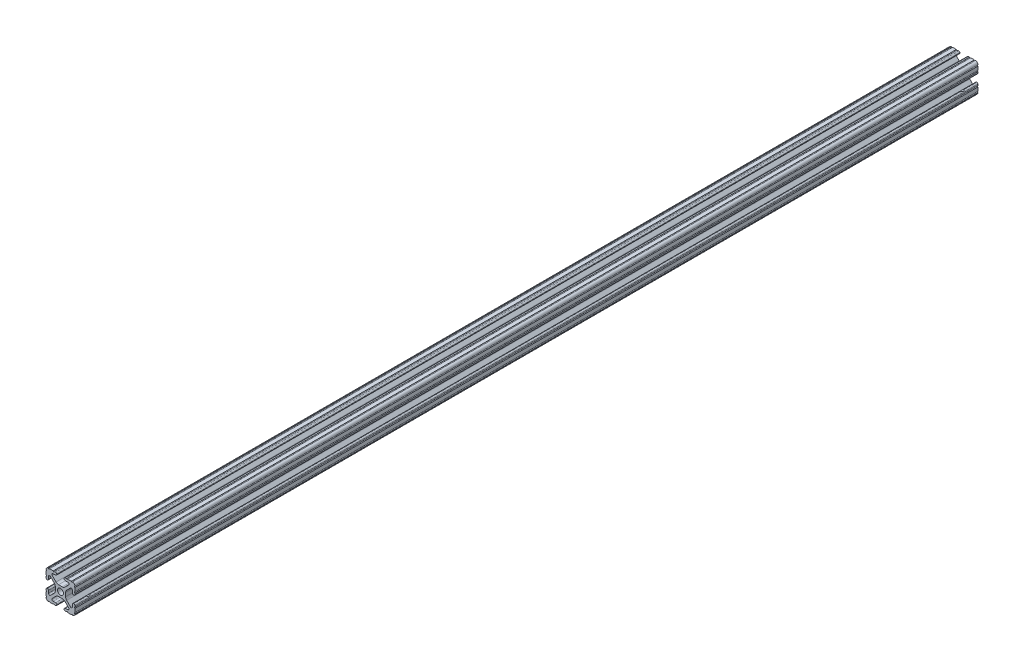
from build123d import *

# Parameters (mm, degrees)
SKETCH1_R               = 2.6035
BOSS_EXTRUDE1_DEPTH     = 396.735
CUT_EXTRUDE1_DEPTH      = 398.31106541
CUT_EXTRUDE1_DEPTH_BACK = 398.31106541
SKETCH2_R               = 3.5


with BuildPart() as part:
    # Sketch1 → Boss-Extrude1 (new, symmetric)
    with BuildSketch(Plane.XY):
        with BuildLine():
            Line((-7.179650497, -8.645192506), (-3.952270251, -5.423690499))
            ThreePointArc((-3.952270251, -5.423690499), (-2.922936451, -4.736929036), (-1.709253557, -4.4958))
            Line((-1.709253557, -4.4958), (1.709253557, -4.4958))
            ThreePointArc((1.709253557, -4.4958), (2.922936451, -4.736929036), (3.952270251, -5.423690499))
            Line((3.952270251, -5.423690499), (7.179650497, -8.645192506))
            ThreePointArc((7.179650497, -8.645192506), (7.41473083, -9.822813117), (6.416408329, -10.4902))
            Line((6.416408329, -10.4902), (4.287512407, -10.4902))
            ThreePointArc((4.287512407, -10.4902), (3.54574862, -10.79744862), (3.2385, -11.539212407))
            Line((3.2385, -11.539212407), (3.2385, -11.650987593))
            ThreePointArc((3.2385, -11.650987593), (3.54574862, -12.39275138), (4.287512407, -12.7))
            Line((4.287512407, -12.7), (5.317126718, -12.7))
            ThreePointArc((5.317126718, -12.7), (5.825126718, -12.192), (6.333126718, -12.7))
            Line((6.333126718, -12.7), (9.550443118, -12.7))
            ThreePointArc((9.550443118, -12.7), (10.058366869, -12.192000006), (10.566443095, -12.699847501))
            ThreePointArc((10.566443095, -12.699847501), (12.082537762, -12.08250727), (12.699846982, -10.566399977))
            ThreePointArc((12.699846982, -10.566399977), (12.192000006, -10.058323491), (12.7, -9.5504))
            Line((12.7, -9.5504), (12.7, -6.3330836))
            ThreePointArc((12.7, -6.3330836), (12.192, -5.8250836), (12.7, -5.3170836))
            Line((12.7, -5.3170836), (12.7, -4.287469289))
            ThreePointArc((12.7, -4.287469289), (12.39275138, -3.545705502), (11.650987593, -3.238456882))
            Line((11.650987593, -3.238456882), (11.539212407, -3.238456882))
            ThreePointArc((11.539212407, -3.238456882), (10.79744862, -3.545705502), (10.4902, -4.287469289))
            Line((10.4902, -4.287469289), (10.4902, -6.402089023))
            ThreePointArc((10.4902, -6.402089023), (9.856505071, -7.351067942), (8.737131347, -7.129408934))
            Line((8.737131347, -7.129408934), (5.441005833, -3.840816462))
            ThreePointArc((5.441005833, -3.840816462), (4.750877967, -2.809883091), (4.5085, -1.593185507))
            Line((4.5085, -1.593185507), (4.5085, 1.593185507))
            ThreePointArc((4.5085, 1.593185507), (4.750877967, 2.809883091), (5.441005833, 3.840816462))
            Line((5.441005833, 3.840816462), (8.737131347, 7.129408934))
            ThreePointArc((8.737131347, 7.129408934), (9.856505071, 7.351067942), (10.4902, 6.402089023))
            Line((10.4902, 6.402089023), (10.4902, 4.287469289))
            ThreePointArc((10.4902, 4.287469289), (10.79744862, 3.545705502), (11.539212407, 3.238456882))
            Line((11.539212407, 3.238456882), (11.650987593, 3.238456882))
            ThreePointArc((11.650987593, 3.238456882), (12.39275138, 3.545705502), (12.7, 4.287469289))
            Line((12.7, 4.287469289), (12.7, 5.3170836))
            ThreePointArc((12.7, 5.3170836), (12.192, 5.8250836), (12.7, 6.3330836))
            Line((12.7, 6.3330836), (12.7, 9.5504))
            ThreePointArc((12.7, 9.5504), (12.192000006, 10.058323491), (12.699846982, 10.566399977))
            ThreePointArc((12.699846982, 10.566399977), (12.082537762, 12.08250727), (10.566443095, 12.699847501))
            ThreePointArc((10.566443095, 12.699847501), (10.058366869, 12.192000006), (9.550443118, 12.7))
            Line((9.550443118, 12.7), (6.333126718, 12.7))
            ThreePointArc((6.333126718, 12.7), (5.825126718, 12.192), (5.317126718, 12.7))
            Line((5.317126718, 12.7), (4.287512407, 12.7))
            ThreePointArc((4.287512407, 12.7), (3.54574862, 12.39275138), (3.2385, 11.650987593))
            Line((3.2385, 11.650987593), (3.2385, 11.539212407))
            ThreePointArc((3.2385, 11.539212407), (3.54574862, 10.79744862), (4.287512407, 10.4902))
            Line((4.287512407, 10.4902), (6.476788598, 10.4902))
            ThreePointArc((6.476788598, 10.4902), (7.432222385, 9.85140422), (7.207036008, 8.724370562))
            Line((7.207036008, 8.724370562), (3.898272566, 5.423169045))
            ThreePointArc((3.898272566, 5.423169045), (2.869120213, 4.736787962), (1.655778399, 4.4958))
            Line((1.655778399, 4.4958), (-1.655778399, 4.4958))
            ThreePointArc((-1.655778399, 4.4958), (-2.869120213, 4.736787962), (-3.898272566, 5.423169045))
            Line((-3.898272566, 5.423169045), (-7.207036008, 8.724370562))
            ThreePointArc((-7.207036008, 8.724370562), (-7.432222385, 9.85140422), (-6.476788598, 10.4902))
            Line((-6.476788598, 10.4902), (-4.287512407, 10.4902))
            ThreePointArc((-4.287512407, 10.4902), (-3.54574862, 10.79744862), (-3.2385, 11.539212407))
            Line((-3.2385, 11.539212407), (-3.2385, 11.650987593))
            ThreePointArc((-3.2385, 11.650987593), (-3.54574862, 12.39275138), (-4.287512407, 12.7))
            Line((-4.287512407, 12.7), (-5.317126718, 12.7))
            ThreePointArc((-5.317126718, 12.7), (-5.825126718, 12.192), (-6.333126718, 12.7))
            Line((-6.333126718, 12.7), (-9.550443118, 12.7))
            ThreePointArc((-9.550443118, 12.7), (-10.058366869, 12.192000006), (-10.566443095, 12.699847501))
            ThreePointArc((-10.566443095, 12.699847501), (-12.082537762, 12.08250727), (-12.699846982, 10.566399977))
            ThreePointArc((-12.699846982, 10.566399977), (-12.192000006, 10.058323491), (-12.7, 9.5504))
            Line((-12.7, 9.5504), (-12.7, 6.3330836))
            ThreePointArc((-12.7, 6.3330836), (-12.192, 5.8250836), (-12.7, 5.3170836))
            Line((-12.7, 5.3170836), (-12.7, 4.287469289))
            ThreePointArc((-12.7, 4.287469289), (-12.39275138, 3.545705502), (-11.650987593, 3.238456882))
            Line((-11.650987593, 3.238456882), (-11.539212407, 3.238456882))
            ThreePointArc((-11.539212407, 3.238456882), (-10.79744862, 3.545705502), (-10.4902, 4.287469289))
            Line((-10.4902, 4.287469289), (-10.4902, 6.402089023))
            ThreePointArc((-10.4902, 6.402089023), (-9.856505071, 7.351067942), (-8.737131347, 7.129408934))
            Line((-8.737131347, 7.129408934), (-5.441005833, 3.840816462))
            ThreePointArc((-5.441005833, 3.840816462), (-4.750877967, 2.809883091), (-4.5085, 1.593185507))
            Line((-4.5085, 1.593185507), (-4.5085, -1.593185507))
            ThreePointArc((-4.5085, -1.593185507), (-4.750877967, -2.809883091), (-5.441005833, -3.840816462))
            Line((-5.441005833, -3.840816462), (-8.737131347, -7.129408934))
            ThreePointArc((-8.737131347, -7.129408934), (-9.856505071, -7.351067942), (-10.4902, -6.402089023))
            Line((-10.4902, -6.402089023), (-10.4902, -4.287469289))
            ThreePointArc((-10.4902, -4.287469289), (-10.79744862, -3.545705502), (-11.539212407, -3.238456882))
            Line((-11.539212407, -3.238456882), (-11.650987593, -3.238456882))
            ThreePointArc((-11.650987593, -3.238456882), (-12.39275138, -3.545705502), (-12.7, -4.287469289))
            Line((-12.7, -4.287469289), (-12.7, -5.3170836))
            ThreePointArc((-12.7, -5.3170836), (-12.192, -5.8250836), (-12.7, -6.3330836))
            Line((-12.7, -6.3330836), (-12.7, -9.5504))
            ThreePointArc((-12.7, -9.5504), (-12.192000006, -10.058323491), (-12.699846982, -10.566399977))
            ThreePointArc((-12.699846982, -10.566399977), (-12.082537762, -12.08250727), (-10.566443095, -12.699847501))
            ThreePointArc((-10.566443095, -12.699847501), (-10.058366869, -12.192000006), (-9.550443118, -12.7))
            Line((-9.550443118, -12.7), (-6.333126718, -12.7))
            ThreePointArc((-6.333126718, -12.7), (-5.825126718, -12.192), (-5.317126718, -12.7))
            Line((-5.317126718, -12.7), (-4.287512407, -12.7))
            ThreePointArc((-4.287512407, -12.7), (-3.54574862, -12.39275138), (-3.2385, -11.650987593))
            Line((-3.2385, -11.650987593), (-3.2385, -11.539212407))
            ThreePointArc((-3.2385, -11.539212407), (-3.54574862, -10.79744862), (-4.287512407, -10.4902))
            Line((-4.287512407, -10.4902), (-6.416408329, -10.4902))
            ThreePointArc((-6.416408329, -10.4902), (-7.41473083, -9.822813117), (-7.179650497, -8.645192506))
        make_face()
        Circle(SKETCH1_R, mode=Mode.SUBTRACT)
    extrude(amount=BOSS_EXTRUDE1_DEPTH, both=True)

    # Sketch2 → Cut-Extrude1 (cut, two sides: drawn at the far end of the back side and taken through both)
    with BuildSketch(Plane(origin=(4.5085, 0, 0), x_dir=(0, 0, -1), z_dir=(1, 0, 0)).offset(-CUT_EXTRUDE1_DEPTH_BACK)):
        with Locations(Location((-384.035, 0, 0), (0, 0, 152.922463145))):
            Circle(SKETCH2_R)
        with Locations(Location((384.035, 0, 0), (0, 0, 152.922463145))):
            Circle(SKETCH2_R)
    extrude(amount=CUT_EXTRUDE1_DEPTH + CUT_EXTRUDE1_DEPTH_BACK, mode=Mode.SUBTRACT)


solid = part.part
